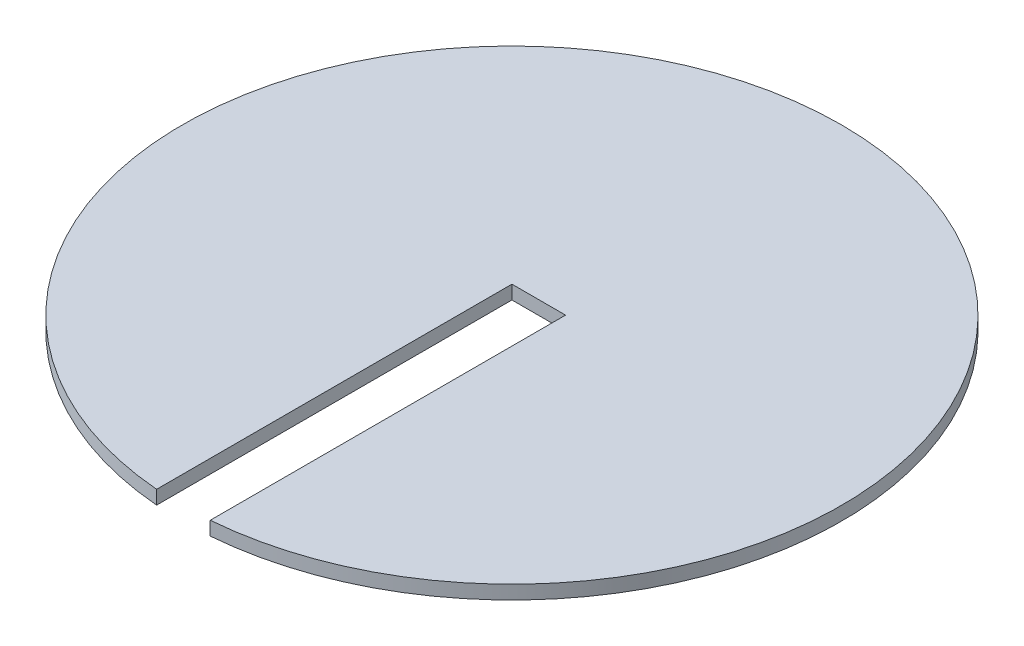
from build123d import *

# Parameters (mm, degrees)
BOSS_EXTRUDE1_DEPTH = 1.5875


with BuildPart() as part:
    # Sketch1 → Boss-Extrude1 (new body)
    with BuildSketch(Plane(origin=(0, 0, 0), x_dir=(1, 0, 0), z_dir=(0, 1, 0))):
        with BuildLine():
            Line((2.408495171, 1.948589223), (2.408495171, -32.925085869))
            ThreePointArc((2.408495171, -32.925085869), (5.508495171, 43.148589223), (8.608495171, -32.925085869))
            Line((8.608495171, -32.925085869), (8.608495171, 1.948589223))
            Line((8.608495171, 1.948589223), (8.608495171, 8.148589223))
            Line((8.608495171, 8.148589223), (2.408495171, 8.148589223))
            Line((2.408495171, 8.148589223), (2.408495171, 1.948589223))
        make_face()
    extrude(amount=BOSS_EXTRUDE1_DEPTH)


solid = part.part
